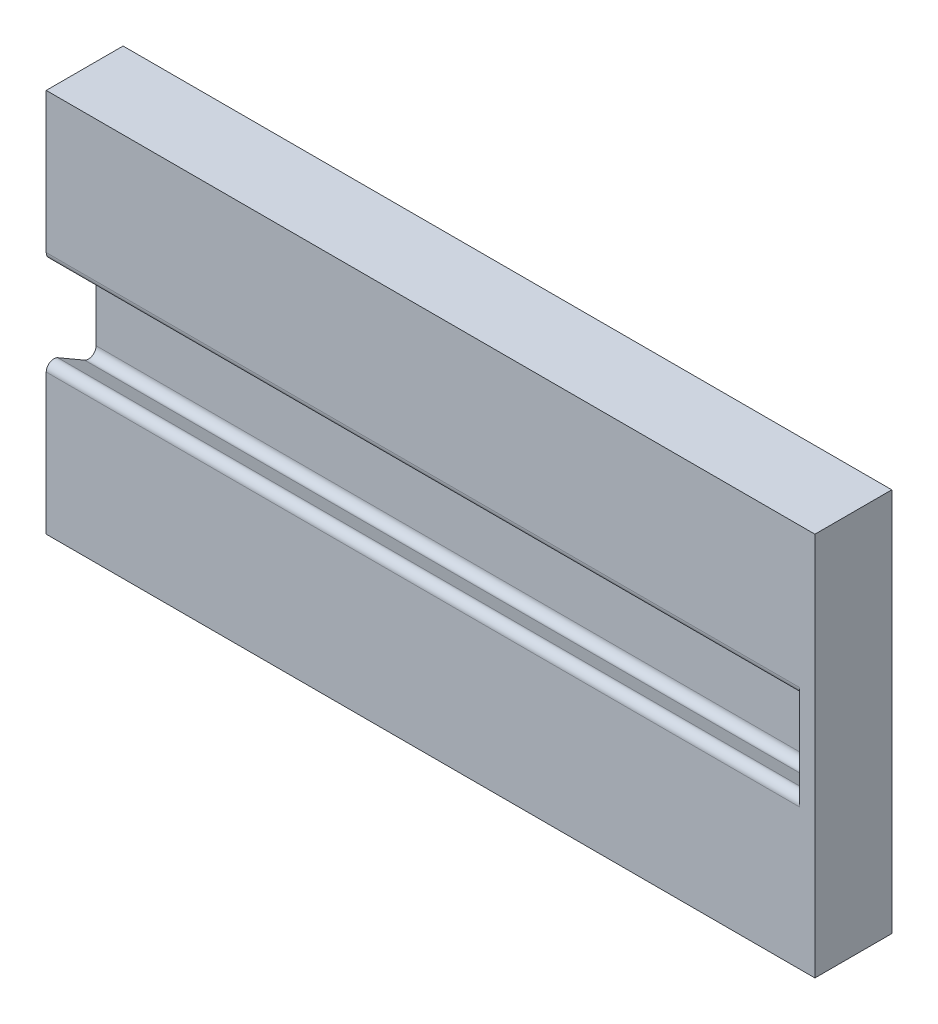
from build123d import *

# Parameters (mm, degrees)
IZIM1_W                     = 100
IZIM1_H                     = 50
Y_KSEKLIK_EKSTR_ZYON1_DEPTH = 10
KES_EKSTR_ZYON1_DEPTH       = 98
RADYUS1_R                   = 1


with BuildPart() as part:
    # Çizim1 → Yükseklik-Ekstrüzyon1 (new body)
    with BuildSketch(Plane.XY):
        Rectangle(IZIM1_W, IZIM1_H)
    extrude(amount=Y_KSEKLIK_EKSTR_ZYON1_DEPTH)

    # Çizim2 → Kes-Ekstrüzyon1 (cut)
    with BuildSketch(Plane.ZY.offset(50)):
        Polygon((10, 5), (3.504809472, 8.75), (3.504809472, -8.75), (10, -5), align=None)
    extrude(amount=-KES_EKSTR_ZYON1_DEPTH, mode=Mode.SUBTRACT)

    # Radyus1
    radyus1_edges = [part.edges().sort_by_distance(p)[0] for p in [
        (-1, 5, 10),
        (-1, -5, 10),
        (-1, -8.75, 3.504809472),
        (-1, 8.75, 3.504809472),
    ]]
    fillet(radyus1_edges, radius=RADYUS1_R)


solid = part.part
